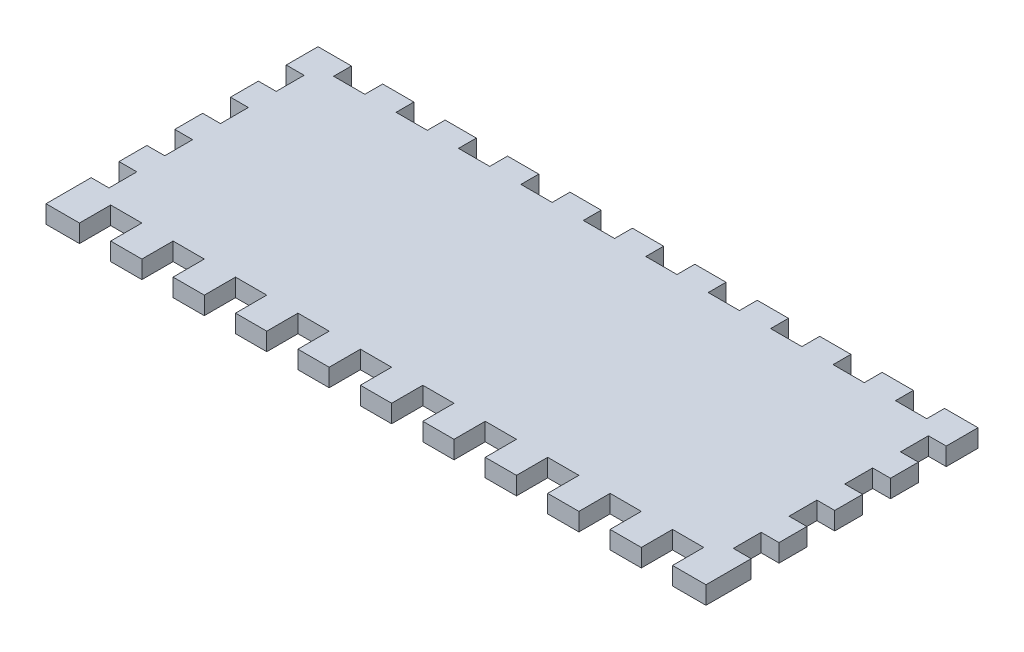
from build123d import *

# Parameters (mm, degrees)
SCHIZZO1_W                   = 140
SCHIZZO1_H                   = 50
ESTRUSIONE_ESTRUSIONE1_DEPTH = 4
ESTRUSIONE_ESTRUSIONE2_DEPTH = 4
SCHIZZO3_W                   = 4
SCHIZZO3_H                   = 6.25
ESTRUSIONE_ESTRUSIONE3_DEPTH = 4
RIPETIZIONE_A_L1_COUNT       = 3
RIPETIZIONE_A_L1_PITCH       = 12.5
SCHIZZO4_W                   = 7
SCHIZZO4_H                   = 4
SCHIZZO4_H_2                 = 7
ESTRUSIONE_ESTRUSIONE4_DEPTH = 4
RIPETIZIONE_A_L2_COUNT       = 9
RIPETIZIONE_A_L2_PITCH       = 14


with BuildPart() as part:
    # Schizzo1 → Estrusione-Estrusione1 (new body)
    with BuildSketch(Plane(origin=(0, 0, 0), x_dir=(1, 0, 0), z_dir=(0, 1, 0))):
        with Locations((70, 25)):
            Rectangle(SCHIZZO1_W, SCHIZZO1_H)
    extrude(amount=ESTRUSIONE_ESTRUSIONE1_DEPTH)

    # Schizzo2 → Estrusione-Estrusione2 (add)
    with BuildSketch(Plane(origin=(0, 4, 0), x_dir=(1, 0, 0), z_dir=(0, 1, 0))):
        Polygon((0, 3.125), (0, 0), (3.5, 0), (3.5, -7), (-4, -7), (-4, 3.125), align=None)
        Polygon((0, 46.875), (-4, 46.875), (-4, 54), (3.5, 54), (3.5, 50), (0, 50), align=None)
        Polygon((136.5, 50), (136.5, 54), (144, 54), (144, 46.875), (140, 46.875), (140, 50), align=None)
        Polygon((140, 3.125), (144, 3.125), (144, -7), (136.5, -7), (136.5, 0), (140, 0), align=None)
    extrude(amount=-ESTRUSIONE_ESTRUSIONE2_DEPTH)

    # Schizzo3 → Estrusione-Estrusione3 (add)
    with BuildSketch(Plane(origin=(0, 4, 0), x_dir=(1, 0, 0), z_dir=(0, 1, 0))):
        with Locations((-2, 37.5)):
            Rectangle(SCHIZZO3_W, SCHIZZO3_H)
        with Locations((142, 37.5)):
            Rectangle(SCHIZZO3_W, SCHIZZO3_H)
    estrusione_estrusione3 = extrude(amount=-ESTRUSIONE_ESTRUSIONE3_DEPTH)

    # Ripetizione a L1: Estrusione-Estrusione3 ×3
    with Locations(*[(0, 0, i * RIPETIZIONE_A_L1_PITCH) for i in range(1, RIPETIZIONE_A_L1_COUNT)]):
        add(estrusione_estrusione3)

    # Schizzo4 → Estrusione-Estrusione4 (add)
    with BuildSketch(Plane(origin=(0, 4, 0), x_dir=(1, 0, 0), z_dir=(0, 1, 0))):
        with Locations((14, 52)):
            Rectangle(SCHIZZO4_W, SCHIZZO4_H)
        with Locations((14, -3.5)):
            Rectangle(SCHIZZO4_W, SCHIZZO4_H_2)
    estrusione_estrusione4 = extrude(amount=-ESTRUSIONE_ESTRUSIONE4_DEPTH)

    # Ripetizione a L2: Estrusione-Estrusione4 ×9
    with Locations(*[(i * RIPETIZIONE_A_L2_PITCH, 0, 0) for i in range(1, RIPETIZIONE_A_L2_COUNT)]):
        add(estrusione_estrusione4)


solid = part.part
